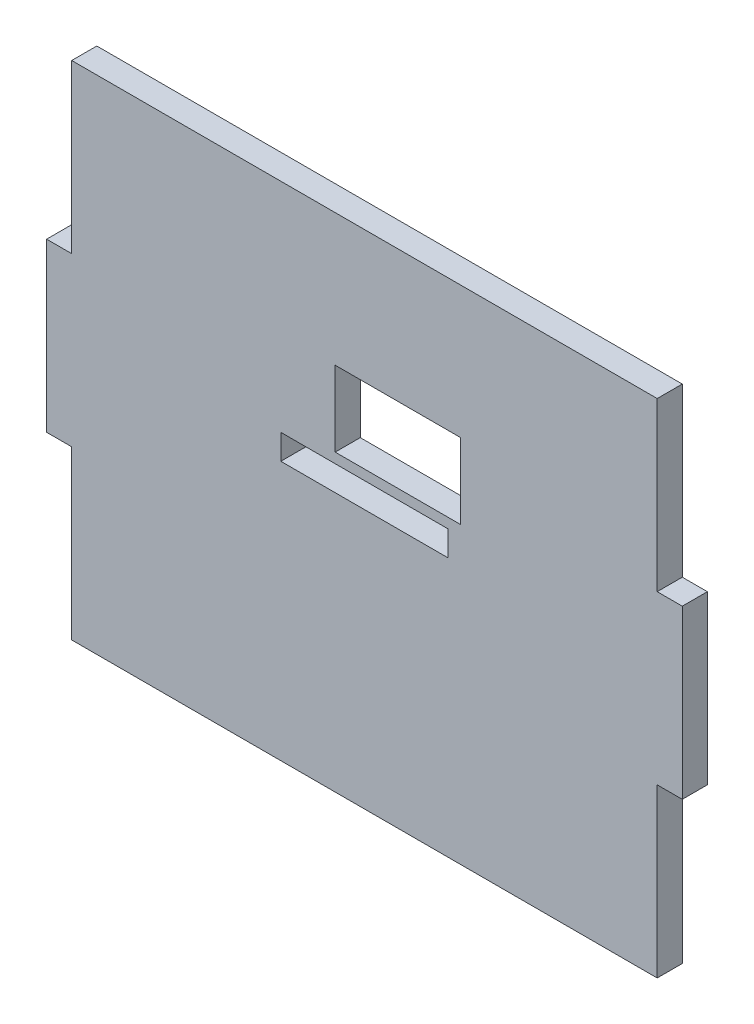
from build123d import *

# Parameters (mm, degrees)
SKETCH1_W           = 70
SKETCH1_H           = 60
BOSS_EXTRUDE1_DEPTH = 3
SKETCH2_W           = 15
SKETCH2_H           = 9
CUT_EXTRUDE1_DEPTH  = 3
SKETCH3_W           = 20
SKETCH3_H           = 3
CUT_EXTRUDE2_DEPTH  = 3
SKETCH4_W           = 3
SKETCH4_H           = 20
BOSS_EXTRUDE2_DEPTH = 3


with BuildPart() as part:
    # Sketch1 → Boss-Extrude1 (new body)
    with BuildSketch(Plane.XY):
        Rectangle(SKETCH1_W, SKETCH1_H)
    extrude(amount=BOSS_EXTRUDE1_DEPTH)

    # Sketch2 → Cut-Extrude1 (cut)
    with BuildSketch(Plane.XY.offset(3)):
        with Locations((4, 9.7)):
            Rectangle(SKETCH2_W, SKETCH2_H)
    extrude(amount=-CUT_EXTRUDE1_DEPTH, mode=Mode.SUBTRACT)

    # Sketch3 → Cut-Extrude2 (cut)
    with BuildSketch(Plane.XY.offset(3)):
        with Locations((0, 2.5)):
            Rectangle(SKETCH3_W, SKETCH3_H)
    extrude(amount=-CUT_EXTRUDE2_DEPTH, mode=Mode.SUBTRACT)

    # Sketch4 → Boss-Extrude2 (add)
    with BuildSketch(Plane.XY.offset(3)):
        with Locations((36.5, 0)):
            Rectangle(SKETCH4_W, SKETCH4_H)
        with Locations((-36.5, 0)):
            Rectangle(SKETCH4_W, SKETCH4_H)
    extrude(amount=-BOSS_EXTRUDE2_DEPTH)


solid = part.part
